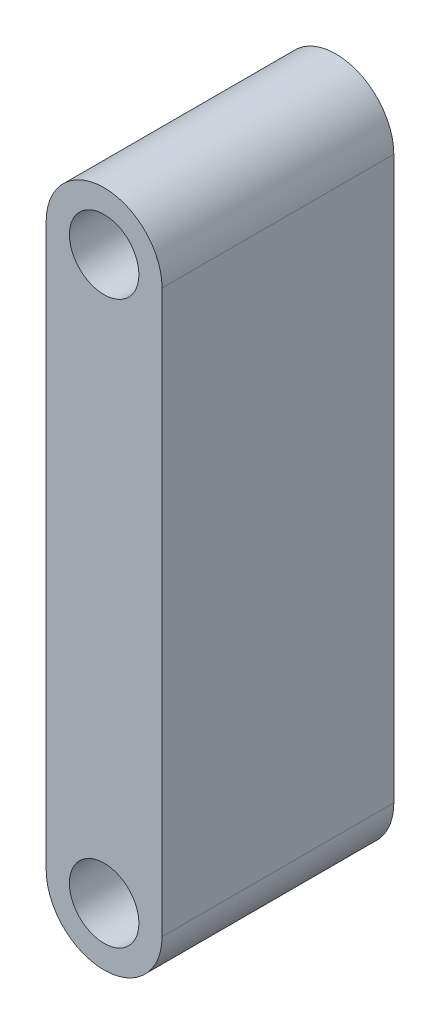
from build123d import *

# Parameters (mm, degrees)
SCHIZZO2_R                   = 15
ESTRUSIONE_ESTRUSIONE1_DEPTH = 50


with BuildPart() as part:
    # Schizzo2 → Estrusione-Estrusione1 (new, symmetric)
    with BuildSketch(Plane.XY):
        with BuildLine():
            Line((25, 202.756382451), (25, -39.643617549))
            ThreePointArc((25, -39.643617549), (0, -64.643617549), (-25, -39.643617549))
            Line((-25, -39.643617549), (-25, 202.756382451))
            ThreePointArc((-25, 202.756382451), (0, 227.756382451), (25, 202.756382451))
        make_face()
        with Locations((0, 202.756382451)):
            Circle(SCHIZZO2_R, mode=Mode.SUBTRACT)
        with Locations((0, -39.643617549)):
            Circle(SCHIZZO2_R, mode=Mode.SUBTRACT)
    extrude(amount=ESTRUSIONE_ESTRUSIONE1_DEPTH, both=True)


solid = part.part
